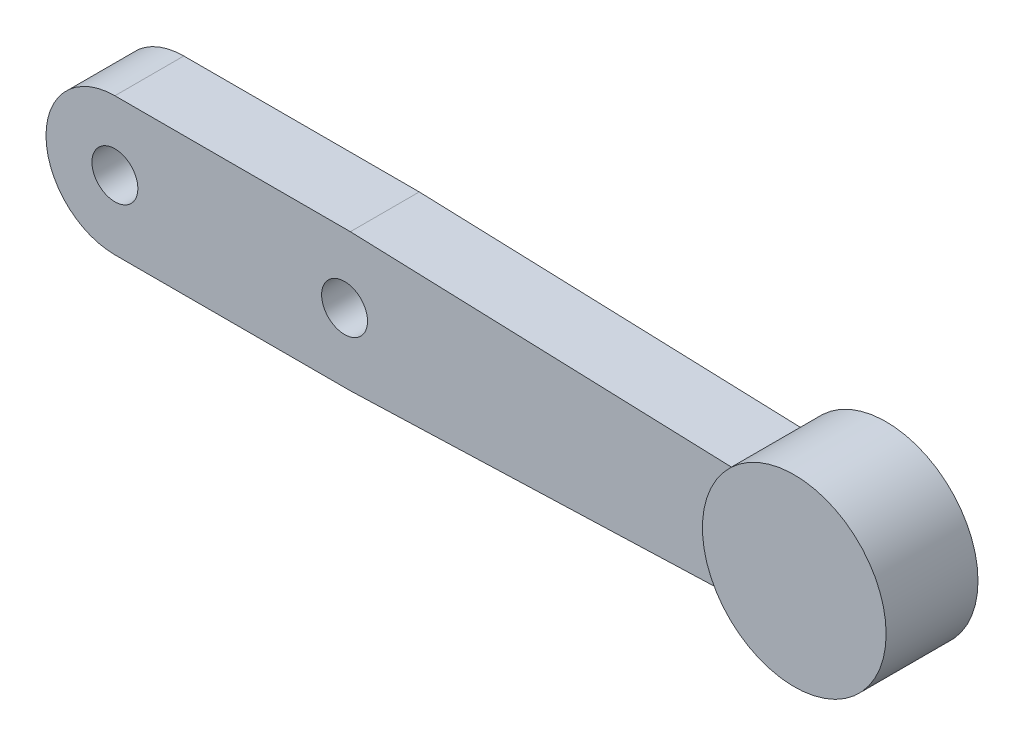
from build123d import *

# Parameters (mm, degrees)
BOSS_EXTRUDE1_DEPTH = 3.75
SKETCH2_R           = 10
BOSS_EXTRUDE2_DEPTH = 5


with BuildPart() as part:
    # Sketch1 → Boss-Extrude1 (new, symmetric)
    with BuildSketch(Plane.XY):
        with BuildLine():
            ThreePointArc((-17.5, 0.005872539), (-19.696699141, 5.309173398), (-25, 7.505872539))
            Line((-25, 7.505872539), (-25, 2.505872539))
            ThreePointArc((-25, 2.505872539), (-23.232233047, 1.773639492), (-22.5, 0.005872539))
            Line((-22.5, 0.005872539), (-17.5, 0.005872539))
        make_face()
        with BuildLine():
            Line((-25, 2.505872539), (-25, 7.505872539))
            ThreePointArc((-25, 7.505872539), (-30.303300859, 5.309173398), (-32.5, 0.005872539))
            Line((-32.5, 0.005872539), (-27.5, 0.005872539))
            ThreePointArc((-27.5, 0.005872539), (-26.767766953, 1.773639492), (-25, 2.505872539))
        make_face()
        with BuildLine():
            ThreePointArc((-25, -7.494127461), (-19.696699141, -5.29742832), (-17.5, 0.005872539))
            Line((-17.5, 0.005872539), (-22.5, 0.005872539))
            ThreePointArc((-22.5, 0.005872539), (-23.232233047, -1.761894414), (-25, -2.494127461))
            Line((-25, -2.494127461), (-25, -7.494127461))
        make_face()
        with BuildLine():
            Line((-27.5, 0.005872539), (-32.5, 0.005872539))
            ThreePointArc((-32.5, 0.005872539), (-30.303300859, -5.29742832), (-25, -7.494127461))
            Line((-25, -7.494127461), (-25, -2.494127461))
            ThreePointArc((-25, -2.494127461), (-26.767766953, -1.761894414), (-27.5, 0.005872539))
        make_face()
        with BuildLine():
            ThreePointArc((50.201457579, -5.763117708), (54.152393819, -4.00404756), (55.772506702, 0.005872539))
            Line((55.772506702, 0.005872539), (2.499993103, 0.005872539))
            ThreePointArc((2.499993103, 0.005872539), (2.499998276, 0.002936272), (2.5, 0))
            ThreePointArc((2.5, 0), (1.869738707, -1.659541253), (0.296738265, -2.482326812))
            ThreePointArc((0.296738265, -2.482326812), (-1.661736132, -1.867788272), (-2.499993103, 0.005872539))
            Line((-2.499993103, 0.005872539), (-17.5, 0.005872539))
            ThreePointArc((-17.5, 0.005872539), (-19.696699141, -5.29742832), (-25, -7.494127461))
            Line((-25, -7.494127461), (0.631823856, -7.494127461))
            Line((0.631823856, -7.494127461), (50.201457579, -5.763117708))
        make_face()
        with BuildLine():
            Line((50.201457579, 5.774862786), (0.631823856, 7.505872539))
            Line((0.631823856, 7.505872539), (-25, 7.505872539))
            ThreePointArc((-25, 7.505872539), (-19.696699141, 5.309173398), (-17.5, 0.005872539))
            Line((-17.5, 0.005872539), (-2.499993103, 0.005872539))
            ThreePointArc((-2.499993103, 0.005872539), (-1.657344084, 1.871686562), (0.296738265, 2.482326812))
            ThreePointArc((0.296738265, 2.482326812), (1.867788272, 1.661736132), (2.499993103, 0.005872539))
            Line((2.499993103, 0.005872539), (55.772506702, 0.005872539))
            ThreePointArc((55.772506702, 0.005872539), (54.152393819, 4.015792638), (50.201457579, 5.774862786))
        make_face()
    extrude(amount=BOSS_EXTRUDE1_DEPTH, both=True)

    # Sketch2 → Boss-Extrude2 (add, symmetric)
    with BuildSketch(Plane.XY):
        with Locations((50.201457579, 0.005872539)):
            Circle(SKETCH2_R)
    extrude(amount=BOSS_EXTRUDE2_DEPTH, both=True)


solid = part.part
